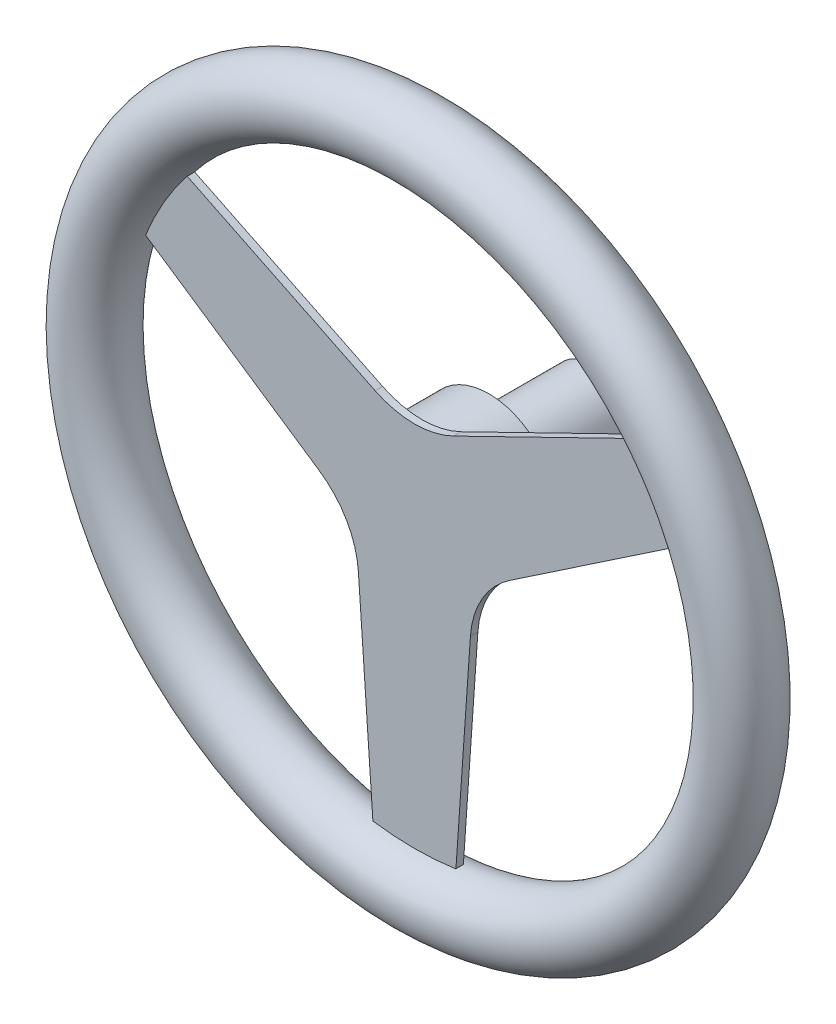
from build123d import *

# Parameters (mm, degrees)
SKETCH1_R           = 14.605
BOSS_EXTRUDE1_DEPTH = 1.5875
SKETCH3_R           = 28.575
BOSS_EXTRUDE2_DEPTH = 28.575
SKETCH4_R           = 17.4625
BOSS_EXTRUDE3_DEPTH = 43.815
CUT_EXTRUDE1_DEPTH  = 54.61


with BuildPart() as part:
    # Sketch1 → Revolve1 (revolve)
    with BuildSketch(Plane(origin=(0, 0, 0), x_dir=(0, 0, -1), z_dir=(1, 0, 0))):
        with Locations((0, 137.795)):
            Circle(SKETCH1_R)
    revolve(axis=Axis((0, 0, -1.447577339), (0, 0, 1)))

    # Sketch2 → Boss-Extrude1 (add, symmetric)
    with BuildSketch(Plane.XY):
        with BuildLine():
            Line((-128.390891494, 55.062409877), (-40.573034005, -4.124601434))
            ThreePointArc((-40.573034005, -4.124601434), (-28.871121899, -16.66875), (-23.858526625, -33.07497744))
            Line((-23.858526625, -33.07497744), (-16.51, -138.720978587))
            Line((-16.51, -138.720978587), (16.51, -138.720978587))
            Line((16.51, -138.720978587), (23.858526625, -33.07497744))
            ThreePointArc((23.858526625, -33.07497744), (28.871121899, -16.66875), (40.573034005, -4.124601434))
            Line((40.573034005, -4.124601434), (128.390891494, 55.062409877))
            Line((128.390891494, 55.062409877), (111.880891494, 83.65856871))
            Line((111.880891494, 83.65856871), (16.71450738, 37.199578874))
            ThreePointArc((16.71450738, 37.199578874), (0, 33.3375), (-16.71450738, 37.199578874))
            Line((-16.71450738, 37.199578874), (-111.880891494, 83.65856871))
            Line((-111.880891494, 83.65856871), (-128.390891494, 55.062409877))
        make_face()
    extrude(amount=BOSS_EXTRUDE1_DEPTH, both=True)

    # Sketch3 → Boss-Extrude2 (add)
    with BuildSketch(Plane(origin=(0, 0, -1.5875), x_dir=(-1, 0, 0), z_dir=(0, 0, -1))):
        Circle(SKETCH3_R)
    extrude(amount=BOSS_EXTRUDE2_DEPTH)

    # Sketch4 → Boss-Extrude3 (add)
    with BuildSketch(Plane(origin=(0, 0, -30.1625), x_dir=(-1, 0, 0), z_dir=(0, 0, -1))):
        Circle(SKETCH4_R)
    extrude(amount=BOSS_EXTRUDE3_DEPTH)

    # Sketch6 → Cut-Extrude1 (cut)
    with BuildSketch(Plane(origin=(0, 0, -73.9775), x_dir=(-1, 0, 0), z_dir=(0, 0, -1))):
        Polygon((12.7, -7.332348419), (12.7, 7.332348419), (0, 14.664696837), (-12.7, 7.332348419), (-12.7, -7.332348419), (0, -14.664696837), align=None)
    extrude(amount=-CUT_EXTRUDE1_DEPTH, mode=Mode.SUBTRACT)


solid = part.part
